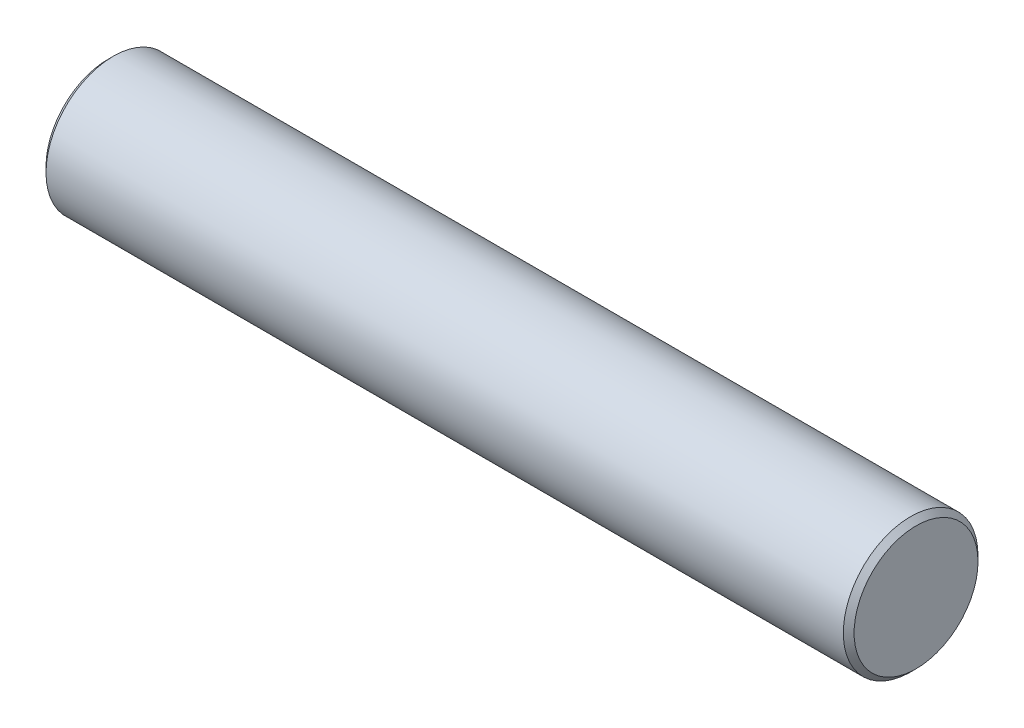
from build123d import *

# Parameters (mm, degrees)
SKETCH1_W     = 30
SKETCH1_H     = 2.5
CHAMFER1_SIZE = 0.2


with BuildPart() as part:
    # Sketch1 → Revolve1 (revolve)
    with BuildSketch(Plane.XY, mode=Mode.PRIVATE) as revolve1_sk:
        with Locations((-15, 1.25)):
            Rectangle(SKETCH1_W, SKETCH1_H)
    revolve(revolve1_sk.sketch.rotate(Axis((0, 0, 0), (-1, 0, 0)), 90), axis=Axis((0, 0, 0), (-1, 0, 0)))

    # Chamfer1
    chamfer1_edges = [part.edges().sort_by_distance(p)[0] for p in [
        (-30, 0, 2.5),
        (0, 0, 2.5),
    ]]
    chamfer(chamfer1_edges, length=CHAMFER1_SIZE)


solid = part.part
